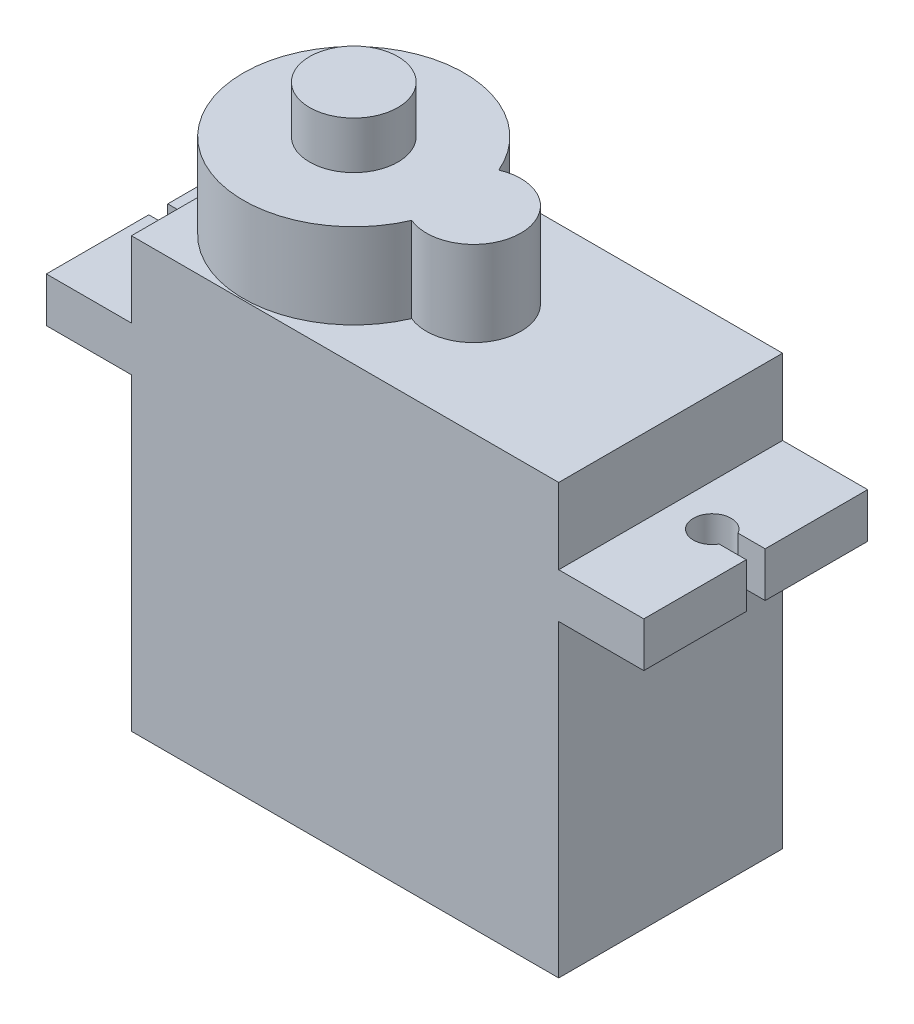
from build123d import *

# Parameters (mm, degrees)
SKETCH1_W            = 22.6
SKETCH1_H            = 11.84
BOSS_EXTRUDE1_DEPTH  = 22.7
SKETCH4_R            = 5.84
BOSS_EXTRUDE6_DEPTH  = 4.5
SKETCH12_R           = 2.335
BOSS_EXTRUDE7_DEPTH  = 2.5
SKETCH13_R           = 2.5
BOSS_EXTRUDE8_DEPTH  = 4.5
SKETCH14_W           = 11.84
SKETCH14_H           = 2.37
BOSS_EXTRUDE10_DEPTH = 4.5
SKETCH15_R           = 1
SKETCH15_W           = 1.5
SKETCH15_H           = 1
CUT_EXTRUDE3_DEPTH   = 51.362478675
SKETCH16_W           = 11.84
SKETCH16_H           = 2.37
BOSS_EXTRUDE11_DEPTH = 4.5
SKETCH17_R           = 1
SKETCH17_W           = 1.5
SKETCH17_H           = 1
CUT_EXTRUDE4_DEPTH   = 55.51962078
SKETCH18_R           = 2.5
CUT_EXTRUDE5_DEPTH   = 3


with BuildPart() as part:
    # Sketch1 → Boss-Extrude1 (new body)
    with BuildSketch(Plane(origin=(0, 0, 0), x_dir=(1, 0, 0), z_dir=(0, 1, 0))):
        with Locations((-34.895532414, -1.336861806)):
            Rectangle(SKETCH1_W, SKETCH1_H)
    extrude(amount=BOSS_EXTRUDE1_DEPTH)

    # Sketch4 → Boss-Extrude6 (add)
    with BuildSketch(Plane(origin=(0, 22.7, 0), x_dir=(-1, 0, 0), z_dir=(0, 1, 0))):
        with Locations((40.355532414, 1.336861806)):
            Circle(SKETCH4_R)
    extrude(amount=BOSS_EXTRUDE6_DEPTH)

    # Sketch12 → Boss-Extrude7 (add)
    with BuildSketch(Plane(origin=(0, 27.2, 0), x_dir=(-1, 0, 0), z_dir=(0, 1, 0))):
        with Locations(Location((40.355532414, 1.336861806, 0), (0, 0, 90))):
            Circle(SKETCH12_R)
    extrude(amount=BOSS_EXTRUDE7_DEPTH)

    # Sketch13 → Boss-Extrude8 (add)
    with BuildSketch(Plane(origin=(0, 22.7, 0), x_dir=(-1, 0, 0), z_dir=(0, 1, 0))):
        with Locations((34.015532414, 1.336861806)):
            Circle(SKETCH13_R)
    extrude(amount=BOSS_EXTRUDE8_DEPTH)

    # Sketch14 → Boss-Extrude10 (add)
    with BuildSketch(Plane(origin=(-23.595532414, 0, 0), x_dir=(0, 0, -1), z_dir=(1, 0, 0))):
        with Locations((-1.336861806, 17.515)):
            Rectangle(SKETCH14_W, SKETCH14_H)
    extrude(amount=BOSS_EXTRUDE10_DEPTH)

    # Sketch15 → Cut-Extrude3 (cut, through all)
    with BuildSketch(Plane(origin=(0, 18.7, 0), x_dir=(-1, 0, 0), z_dir=(0, 1, 0))):
        with Locations((21.395532414, 1.336861806)):
            Circle(SKETCH15_R)
        with Locations((48.395532414, 1.336861806)):
            Circle(SKETCH15_R)
        with Locations((19.845532414, 1.336861806)):
            Rectangle(SKETCH15_W, SKETCH15_H)
    extrude(amount=-CUT_EXTRUDE3_DEPTH, mode=Mode.SUBTRACT)

    # Sketch16 → Boss-Extrude11 (add)
    with BuildSketch(Plane.ZY.offset(46.195532414)):
        with Locations((1.336861806, 17.515)):
            Rectangle(SKETCH16_W, SKETCH16_H)
    extrude(amount=BOSS_EXTRUDE11_DEPTH)

    # Sketch17 → Cut-Extrude4 (cut, through all)
    with BuildSketch(Plane(origin=(0, 18.7, 0), x_dir=(-1, 0, 0), z_dir=(0, 1, 0))):
        with Locations((48.295532414, 1.336861806)):
            Circle(SKETCH17_R)
        with Locations((49.945532414, 1.336861806)):
            Rectangle(SKETCH17_W, SKETCH17_H)
    extrude(amount=-CUT_EXTRUDE4_DEPTH, mode=Mode.SUBTRACT)

    # Sketch18 → Cut-Extrude5 (cut)
    with BuildSketch(Plane(origin=(0, 0, 0), x_dir=(-1, 0, 0), z_dir=(0, -1, 0))):
        with Locations(Location((40.355532414, -1.336861806, 0), (0, 0, 90))):
            Circle(SKETCH18_R)
    extrude(amount=-CUT_EXTRUDE5_DEPTH, mode=Mode.SUBTRACT)


solid = part.part
